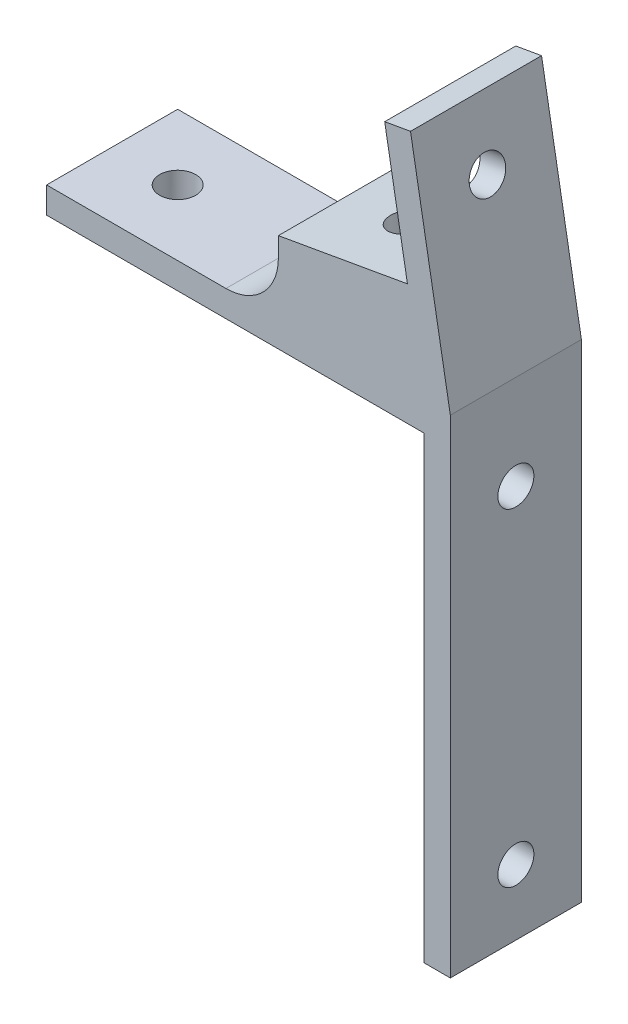
from build123d import *

# Parameters (mm, degrees)
BOSS_EXTRUDE1_DEPTH = 20
CUT_EXTRUDE5_REACH  = 126.766
SKETCH6_R           = 2.74999595
CUT_EXTRUDE10_REACH = 133.489
SKETCH11_R          = 2.75
CUT_EXTRUDE11_REACH = 100.344
SKETCH12_R          = 2.75
SKETCH13_R          = 2.75
CUT_EXTRUDE12_DEPTH = 4
CUT_EXTRUDE13_REACH = 99.421
SKETCH14_R          = 5


with BuildPart() as part:
    # Sketch1 → Boss-Extrude1 (new body)
    with BuildSketch(Plane.XY):
        with BuildLine():
            Line((0, 74.379660875), (-6.077686218, 108.84793223))
            Line((-6.077686218, 108.84793223), (-10.01691723, 108.153339519))
            Line((-10.01691723, 108.153339519), (-6.543953677, 88.457184459))
            Line((-6.543953677, 88.457184459), (-26.240108737, 84.984220906))
            Line((-26.240108737, 84.984220906), (-26.240108737, 81.999969263))
            ThreePointArc((-26.240108737, 81.999969263), (-28.583254488, 76.343115014), (-34.240108737, 73.999969263))
            Line((-34.240108737, 73.999969263), (-61.608001, 73.999969263))
            Line((-61.608001, 73.999969263), (-61.608001, 69.999969263))
            Line((-61.608001, 69.999969263), (-4, 69.999969263))
            Line((-4, 69.999969263), (-4, 0))
            Line((-4, 0), (0, 0))
            Line((0, 0), (0, 74.379660875))
        make_face()
    extrude(amount=BOSS_EXTRUDE1_DEPTH)

    # Sketch6 → Cut-Extrude5 (cut, up to next)
    with BuildSketch(Plane.ZY.offset(4), mode=Mode.PRIVATE) as cut_extrude5_sk1:
        with Locations((9.9999995, 59.999977673)):
            Circle(SKETCH6_R)
    cut_extrude5_tool1 = extrude(cut_extrude5_sk1.sketch, amount=-CUT_EXTRUDE5_REACH, mode=Mode.PRIVATE) & part.part
    # Sketch6 → Cut-Extrude5 (cut, up to next)
    with BuildSketch(Plane.ZY.offset(4), mode=Mode.PRIVATE) as cut_extrude5_sk2:
        with Locations((9.9999995, 9.999962864)):
            Circle(SKETCH6_R)
    cut_extrude5_tool2 = extrude(cut_extrude5_sk2.sketch, amount=-CUT_EXTRUDE5_REACH, mode=Mode.PRIVATE) & part.part
    add(cut_extrude5_tool1.solids().sort_by_distance((-4, 59.999978, 9.999999))[0], mode=Mode.SUBTRACT)
    add(cut_extrude5_tool2.solids().sort_by_distance((-4, 9.999963, 9.999999))[0], mode=Mode.SUBTRACT)

    # Sketch11 → Cut-Extrude10 (cut, up to next)
    with BuildSketch(Plane(origin=(12.719671136, 2.242821207, 0), x_dir=(0, 0, -1), z_dir=(0.9848077530122074, 0.1736481776669349, 0)), mode=Mode.PRIVATE) as cut_extrude10_sk1:
        with Locations(Location((-10, 98.249666696, 0), (0, 0, 90))):
            Circle(SKETCH11_R)
    cut_extrude10_tool1 = extrude(cut_extrude10_sk1.sketch, amount=-CUT_EXTRUDE10_REACH, mode=Mode.PRIVATE) & part.part
    add(cut_extrude10_tool1.solids().sort_by_distance((-4.341204, 98.999855, 10))[0], mode=Mode.SUBTRACT)

    # Sketch12 → Cut-Extrude11 (cut, up to next)
    with BuildSketch(Plane(origin=(0, 73.999969263, 0), x_dir=(1, 0, 0), z_dir=(0, 1, 0)), mode=Mode.PRIVATE) as cut_extrude11_sk1:
        with Locations(Location((-51.608001, -10, 0), (0, 0, 270))):
            Circle(SKETCH12_R)
    cut_extrude11_tool1 = extrude(cut_extrude11_sk1.sketch, amount=-CUT_EXTRUDE11_REACH, mode=Mode.PRIVATE) & part.part
    add(cut_extrude11_tool1.solids().sort_by_distance((-51.608001, 73.999969, 10))[0], mode=Mode.SUBTRACT)

    # Sketch13 → Cut-Extrude12 (cut)
    with BuildSketch(Plane(origin=(-15.324393801, 86.908955963, 0), x_dir=(0.9848077530122072, 0.17364817766693516, 0), z_dir=(-0.1736481776669352, 0.9848077530122074, 0))):
        with Locations(Location((-1.084107434, -10, 0), (0, 0, 180))):
            Circle(SKETCH13_R)
    extrude(amount=-CUT_EXTRUDE12_DEPTH, mode=Mode.SUBTRACT)

    # Cut-Extrude13: up to this plane
    cut_extrude13_end = Plane(origin=(-4, 69.999969263, 20), z_dir=(0, -1, 0))
    # Sketch14 → Cut-Extrude13 (cut, up to the surface)
    with BuildSketch(Plane(origin=(-14.629801091, 82.969724951, 0), x_dir=(0.9848077530122072, 0.17364817766693522, 0), z_dir=(-0.17364817766693524, 0.9848077530122074, 0)), mode=Mode.PRIVATE) as cut_extrude13_sk1:
        with Locations(Location((-1.084107434, -10, 0), (0, 0, 180))):
            Circle(SKETCH14_R)
    cut_extrude13_tool1 = split(extrude(cut_extrude13_sk1.sketch, amount=-CUT_EXTRUDE13_REACH, mode=Mode.PRIVATE), bisect_by=cut_extrude13_end, keep=Keep.BOTH, mode=Mode.PRIVATE)
    add(cut_extrude13_tool1.solids().sort_by_distance((-15.697438, 82.781472, 10))[0], mode=Mode.SUBTRACT)


solid = part.part
